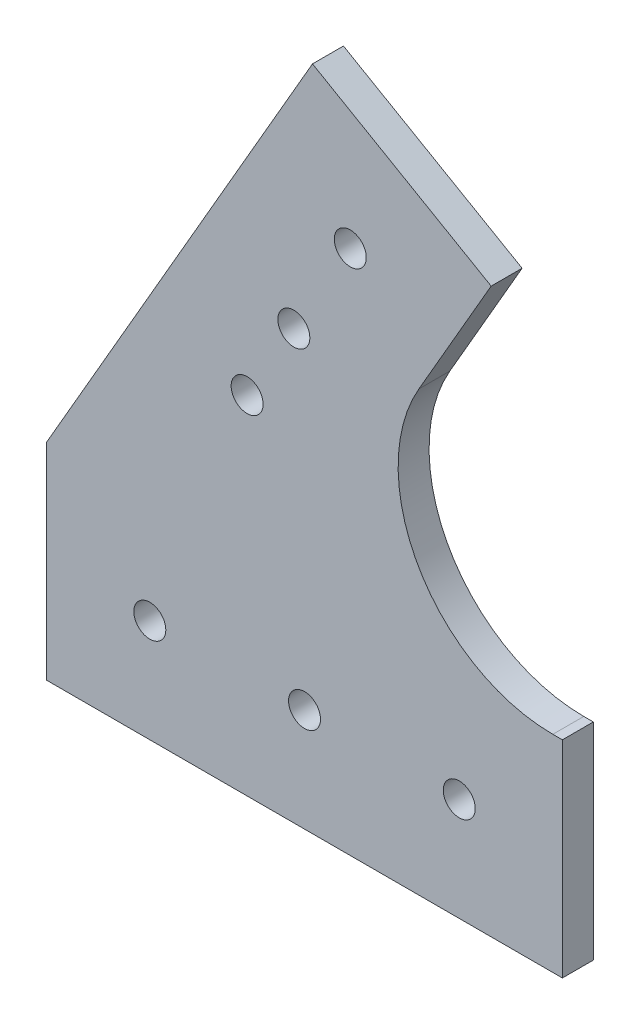
from build123d import *

# Parameters (mm, degrees)
SKETCH_1_R      = 1.55
EXTRUDE_1_DEPTH = 3
FILLET_1_R      = 15


with BuildPart() as part:
    # 草图1 → 凸台-拉伸1 (new body)
    with BuildSketch(Plane.XY):
        Polygon((0.773502692, 54.641016151), (-25, 10), (-25, -10), (25, -10), (25, 10), (-1.905989232, 10), (18.094010768, 44.641016151), align=None)
        with Locations((-5.56624327, 23.660254038)):
            Circle(SKETCH_1_R, mode=Mode.SUBTRACT)
        with Locations((-1.035875539, 31.507081126)):
            Circle(SKETCH_1_R, mode=Mode.SUBTRACT)
        with Locations((4.43375673, 40.980762114)):
            Circle(SKETCH_1_R, mode=Mode.SUBTRACT)
        with Locations((15, 0)):
            Circle(SKETCH_1_R, mode=Mode.SUBTRACT)
        with Locations((-15, 0)):
            Circle(SKETCH_1_R, mode=Mode.SUBTRACT)
        Circle(SKETCH_1_R, mode=Mode.SUBTRACT)
    extrude(amount=EXTRUDE_1_DEPTH)

    # 圆角1
    fillet_1_edges = [part.edges().sort_by_distance(p)[0] for p in [
        (-1.905989232, 10, 1.5),
    ]]
    fillet(fillet_1_edges, radius=FILLET_1_R)


solid = part.part
